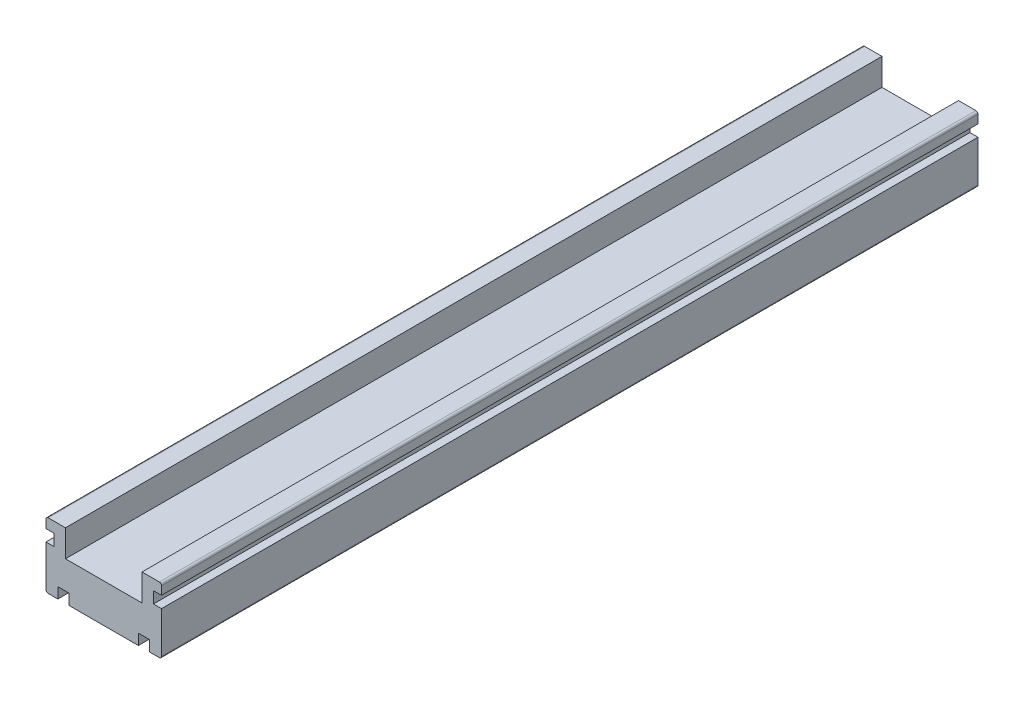
from build123d import *

# Parameters (mm, degrees)
SKETCH1_W           = 43
SKETCH1_H           = 24.4
BOSS_EXTRUDE1_DEPTH = 304
FILLET1_R           = 0.8
SKETCH3_W           = 3
SKETCH3_H           = 4.3
CUT_EXTRUDE1_DEPTH  = 306.00342621
SKETCH5_W           = 28.5
SKETCH5_H           = 10
CUT_EXTRUDE2_DEPTH  = 306.00342621
SKETCH6_W           = 4.2
SKETCH6_H           = 8
CUT_EXTRUDE3_DEPTH  = 306.00342621


with BuildPart() as part:
    # Sketch1 → Boss-Extrude1 (new body)
    with BuildSketch(Plane.XY):
        Rectangle(SKETCH1_W, SKETCH1_H)
    extrude(amount=BOSS_EXTRUDE1_DEPTH)

    # Fillet1
    fillet1_edges = [part.edges().sort_by_distance(p)[0] for p in [
        (21.5, -12.2, 152),
        (-21.5, -12.2, 152),
        (-21.5, 12.2, 152),
        (21.5, 12.2, 152),
    ]]
    fillet(fillet1_edges, radius=FILLET1_R)

    # Sketch3 → Cut-Extrude1 (cut, through all)
    with BuildSketch(Plane(origin=(0, 0, 0), x_dir=(-1, 0, 0), z_dir=(0, 0, -1))):
        with Locations((-20, 6.15)):
            Rectangle(SKETCH3_W, SKETCH3_H)
        with Locations((20, 6.15)):
            Rectangle(SKETCH3_W, SKETCH3_H)
    extrude(amount=-CUT_EXTRUDE1_DEPTH, mode=Mode.SUBTRACT)

    # Sketch5 → Cut-Extrude2 (cut, through all)
    with BuildSketch(Plane(origin=(0, 0, 0), x_dir=(-1, 0, 0), z_dir=(0, 0, -1))):
        with Locations((0, 7.2)):
            Rectangle(SKETCH5_W, SKETCH5_H)
    extrude(amount=-CUT_EXTRUDE2_DEPTH, mode=Mode.SUBTRACT)

    # Sketch6 → Cut-Extrude3 (cut, through all)
    with BuildSketch(Plane(origin=(0, 0, 0), x_dir=(-1, 0, 0), z_dir=(0, 0, -1))):
        with Locations((-15, -12.2)):
            Rectangle(SKETCH6_W, SKETCH6_H)
        with Locations((15, -12.2)):
            Rectangle(SKETCH6_W, SKETCH6_H)
    extrude(amount=-CUT_EXTRUDE3_DEPTH, mode=Mode.SUBTRACT)


solid = part.part
